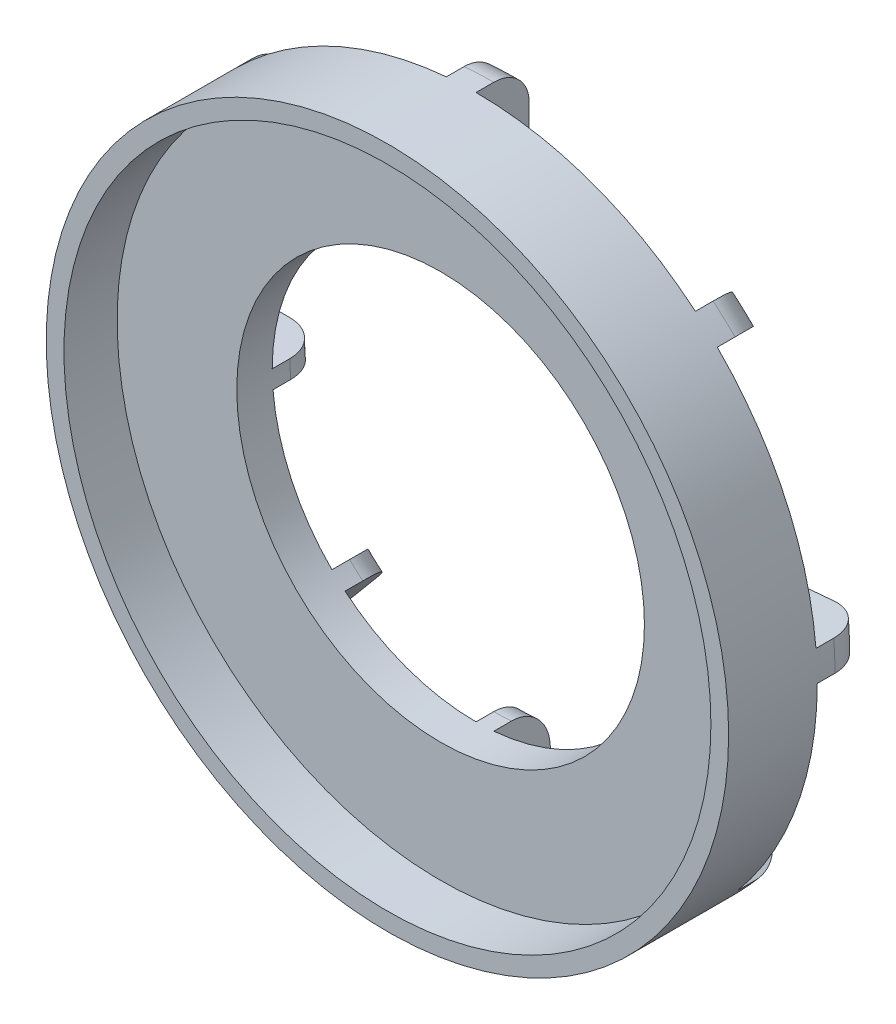
from build123d import *
from build123d.topology import SkipClean

# Parameters (mm, degrees)
SKETCH1_R                = 18.25
SKETCH1_R_2              = 11.5
BOSS_EXTRUDE1_DEPTH      = 2
SKETCH1_4_R              = 19.25
SKETCH1_4_R_2            = 18.25
BOSS_EXTRUDE2_DEPTH      = 5
BOSS_EXTRUDE3_START      = 3
BOSS_EXTRUDE3_DEPTH      = 3
FILLET2_R                = 2
CIRPATTERN1_COUNT        = 8
FILLET2_OF_CIRPATTERN1_R = 2


with BuildPart() as part:
    # Sketch1 → Boss-Extrude1 (new body)
    with BuildSketch(Plane.XY):
        Circle(SKETCH1_R)
        Circle(SKETCH1_R_2, mode=Mode.SUBTRACT)
    extrude(amount=BOSS_EXTRUDE1_DEPTH)

    # Sketch1<4> → Boss-Extrude2 (add)
    with BuildSketch(Plane.XY):
        Circle(SKETCH1_4_R)
        Circle(SKETCH1_4_R_2, mode=Mode.SUBTRACT)
    extrude(amount=BOSS_EXTRUDE2_DEPTH)

    # Sketch2 → Boss-Extrude3 (add)
    with SkipClean():  # the faces are left unmerged after this step: merging them gives an invalid solid
        with BuildSketch(Plane(origin=(0, 0, 0), x_dir=(-1, 0, 0), z_dir=(0, 0, -1)).offset(BOSS_EXTRUDE3_START)):
            with BuildLine():
                ThreePointArc((1.677748048, 19.176747938), (0.839673207, 19.231678265), (0, 19.25))
                Line((0, 19.25), (0, 11.5))
                ThreePointArc((0, 11.5), (0.501622955, 11.489054548), (1.002291042, 11.456239028))
                Line((1.002291042, 11.456239028), (1.677748048, 19.176747938))
            make_face()
        boss_extrude3 = extrude(amount=-BOSS_EXTRUDE3_DEPTH)

    # Fillet2
    fillet2_edges = [part.edges().sort_by_distance(p)[0] for p in [
        (-0.839673207, 19.231678265, -3),
        (-0.501622955, 11.489054548, -3),
    ]]
    fillet(fillet2_edges, radius=FILLET2_R)

    # CirPattern1: Boss-Extrude3 ×8 about axis
    with SkipClean():  # the faces are left unmerged after this step: merging them gives an invalid solid
        cirpattern1_axis = Axis((0, 0, 5.4), (0, 0, -1))
        for i in range(1, CIRPATTERN1_COUNT):
            add(boss_extrude3.rotate(cirpattern1_axis, i * 360 / CIRPATTERN1_COUNT))

    # Fillet2 of CirPattern1
    fillet2_of_cirpattern1_edges = [part.edges().sort_by_distance(p)[0] for p in [
        (13.005111497, 14.192588734, -3),
        (7.769287388, 8.478689373, -3),
        (19.231678265, 0.839673207, -3),
        (11.489054548, 0.501622955, -3),
        (14.192588734, -13.005111497, -3),
        (8.478689373, -7.769287388, -3),
        (0.839673207, -19.231678265, -3),
        (0.501622955, -11.489054548, -3),
        (-13.005111497, -14.192588734, -3),
        (-7.769287388, -8.478689373, -3),
        (-19.231678265, -0.839673207, -3),
        (-11.489054548, -0.501622955, -3),
        (-14.192588734, 13.005111497, -3),
        (-8.478689373, 7.769287388, -3),
    ]]
    fillet(fillet2_of_cirpattern1_edges, radius=FILLET2_OF_CIRPATTERN1_R)


solid = part.part
